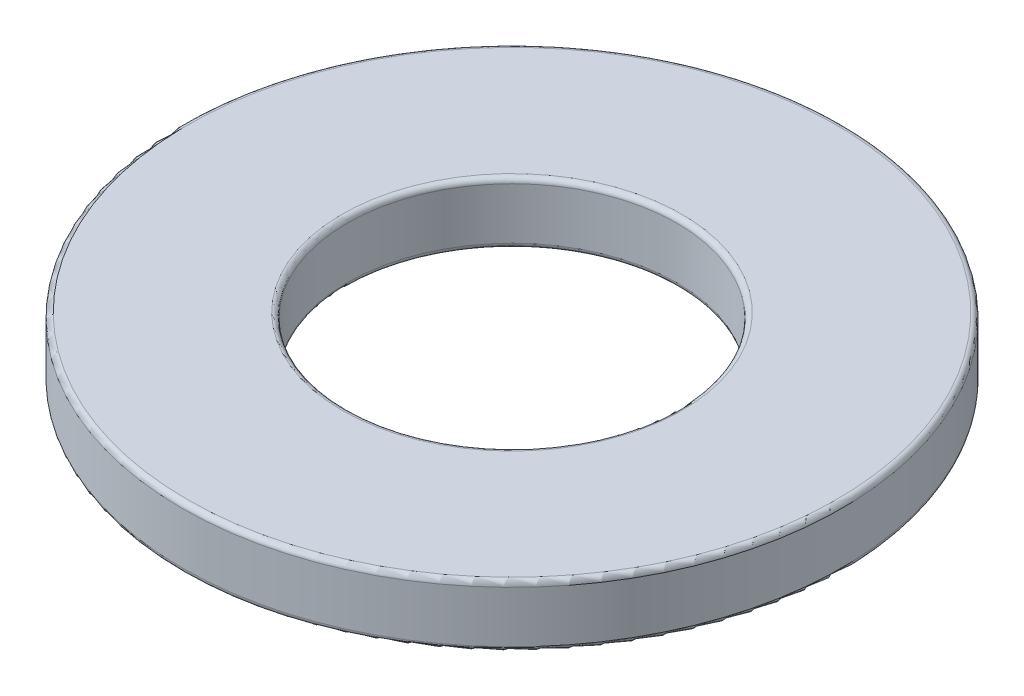
from build123d import *


with BuildPart() as part:
    # Sketch1 → Revolve1 (revolve)
    with BuildSketch(Plane(origin=(0, 0, 0), x_dir=(0, 0, -1), z_dir=(1, 0, 0))):
        with BuildLine():
            Line((-16, 1.25), (-16, -1.25))
            ThreePointArc((-16, -1.25), (-15.926776695, -1.426776695), (-15.75, -1.5))
            Line((-15.75, -1.5), (-8.25, -1.5))
            ThreePointArc((-8.25, -1.5), (-8.073223305, -1.426776695), (-8, -1.25))
            Line((-8, -1.25), (-8, 1.25))
            ThreePointArc((-8, 1.25), (-8.073223305, 1.426776695), (-8.25, 1.5))
            Line((-8.25, 1.5), (-15.75, 1.5))
            ThreePointArc((-15.75, 1.5), (-15.926776695, 1.426776695), (-16, 1.25))
        make_face()
    revolve(axis=Axis((0, 17.907639975, 0), (0, -1, 0)))


solid = part.part
